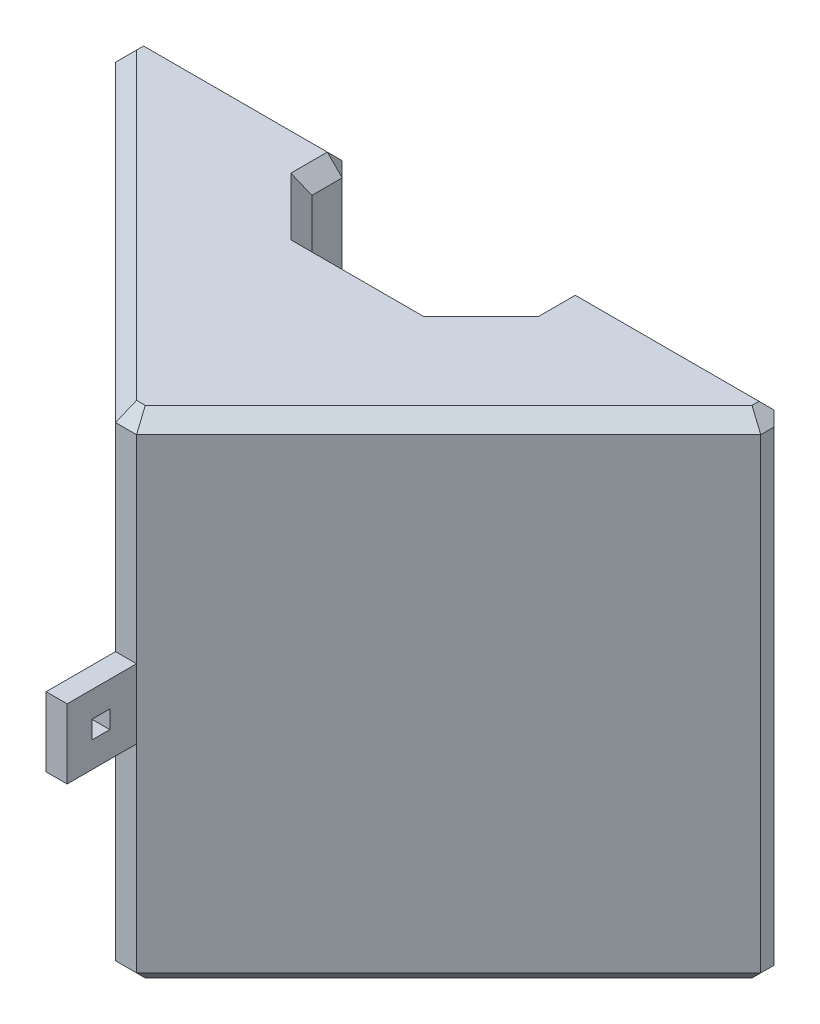
from build123d import *
from OCP.BRepFilletAPI import BRepFilletAPI_MakeChamfer

# Parameters (mm, degrees)
BOSS_EXTRUDE1_DEPTH = 50
CUT_EXTRUDE3_DEPTH  = 94.541434669
CHAMFER2_SIZE       = 4
CHAMFER2_SIZE2      = 2.828427125
CHAMFER3_SIZE       = 1.5
CHAMFER4_SIZE       = 1.5
SKETCH6_W           = 2.121320343
SKETCH6_H           = 7
BOSS_EXTRUDE2_DEPTH = 7
SKETCH7_W           = 1.8
SKETCH7_H           = 1.8
CUT_EXTRUDE4_DEPTH  = 7


with BuildPart() as part:
    # Sketch4 → Boss-Extrude1 (new body)
    with BuildSketch(Plane(origin=(0, 0, 0), x_dir=(1, 0, 0), z_dir=(0, 1, 0))):
        Polygon((0, 0), (70.710678119, 0), (35.355339059, -35.355339059), align=None)
    extrude(amount=BOSS_EXTRUDE1_DEPTH)

    # Sketch5 → Cut-Extrude3 (cut, through all)
    with BuildSketch(Plane.XZ):
        Polygon((39.911688245, 11), (30.798989873, 11), (24.355339059, 4.556349186), (24.355339059, -4.556349186), (30.798989873, -11), (39.911688245, -11), (46.355339059, -4.556349186), (46.355339059, 4.556349186), align=None)
    extrude(amount=-CUT_EXTRUDE3_DEPTH, mode=Mode.SUBTRACT)

    # Chamfer2: one chamfer whose edges measure the first distance from different faces: ONE call of the kernel's chamfer builder (chamfer() names one face for all edges)
    chamfer2_edges_1 = [part.edges().sort_by_distance(p)[0] for p in [
        (0, 25, 0),
    ]]
    chamfer2_side_1 = [part.faces().sort_by_distance(p)[0] for p in [
        (17.67766953, 25, 17.67766953),
    ]]
    chamfer2_edges_2 = [part.edges().sort_by_distance(p)[0] for p in [
        (70.710678119, 25, 0),
    ]]
    chamfer2_side_2 = [part.faces().sort_by_distance(p)[0] for p in [
        (53.033008589, 25, 17.67766953),
    ]]
    chamfer2 = BRepFilletAPI_MakeChamfer(part.part.solid().wrapped)
    for e in chamfer2_edges_1:
        chamfer2.Add(CHAMFER2_SIZE, CHAMFER2_SIZE2, e.wrapped, chamfer2_side_1[0].wrapped)  # the first distance lies on this face
    for e in chamfer2_edges_2:
        chamfer2.Add(CHAMFER2_SIZE, CHAMFER2_SIZE2, e.wrapped, chamfer2_side_2[0].wrapped)  # the first distance lies on this face
    add(Compound.cast(chamfer2.Shape()), mode=Mode.REPLACE)

    # Chamfer3
    chamfer3_edges = [part.edges().sort_by_distance(p)[0] for p in [
        (13.591883092, 0, 0),
        (46.355339059, 0, 2.278174593),
        (13.591883092, 50, 0),
        (24.355339059, 0, 2.278174593),
        (43.133513652, 0, 7.778174593),
        (27.577164466, 0, 7.778174593),
        (46.355339059, 25, 0),
        (46.355339059, 50, 2.278174593),
        (24.355339059, 50, 2.278174593),
        (24.355339059, 25, 0),
        (43.133513652, 50, 7.778174593),
        (27.577164466, 50, 7.778174593),
        (57.118795027, 0, 0),
        (2.828427125, 25, 0),
        (57.118795027, 50, 0),
        (67.882250994, 25, 0),
        (35.355339059, 25, 35.355339059),
    ]]
    chamfer(chamfer3_edges, length=CHAMFER3_SIZE)

    # Chamfer4
    chamfer4_edges = [part.edges().sort_by_distance(p)[0] for p in [
        (18.561553006, 0, 18.561553006),
        (18.561553006, 50, 18.561553006),
        (2.828427125, 0, 2.164213562),
        (67.882250994, 50, 2.164213562),
        (2.828427125, 50, 2.164213562),
        (52.149125113, 50, 18.561553006),
        (35.355339059, 50, 34.294678888),
        (67.882250994, 0, 2.164213562),
        (52.149125113, 0, 18.561553006),
        (35.355339059, 0, 34.294678888),
    ]]
    chamfer(chamfer4_edges, length=CHAMFER4_SIZE)

    # Sketch6 → Boss-Extrude2 (add)
    with BuildSketch(Plane.XY.offset(34.294678888)):
        with Locations((35.355339059, 25)):
            Rectangle(SKETCH6_W, SKETCH6_H)
    extrude(amount=BOSS_EXTRUDE2_DEPTH)

    # Sketch7 → Cut-Extrude4 (cut)
    with BuildSketch(Plane(origin=(36.415999231, 0, 0), x_dir=(0, 0, -1), z_dir=(1, 0, 0))):
        with Locations((-37.894678888, 25)):
            Rectangle(SKETCH7_W, SKETCH7_H)
    extrude(amount=-CUT_EXTRUDE4_DEPTH, mode=Mode.SUBTRACT)


solid = part.part
